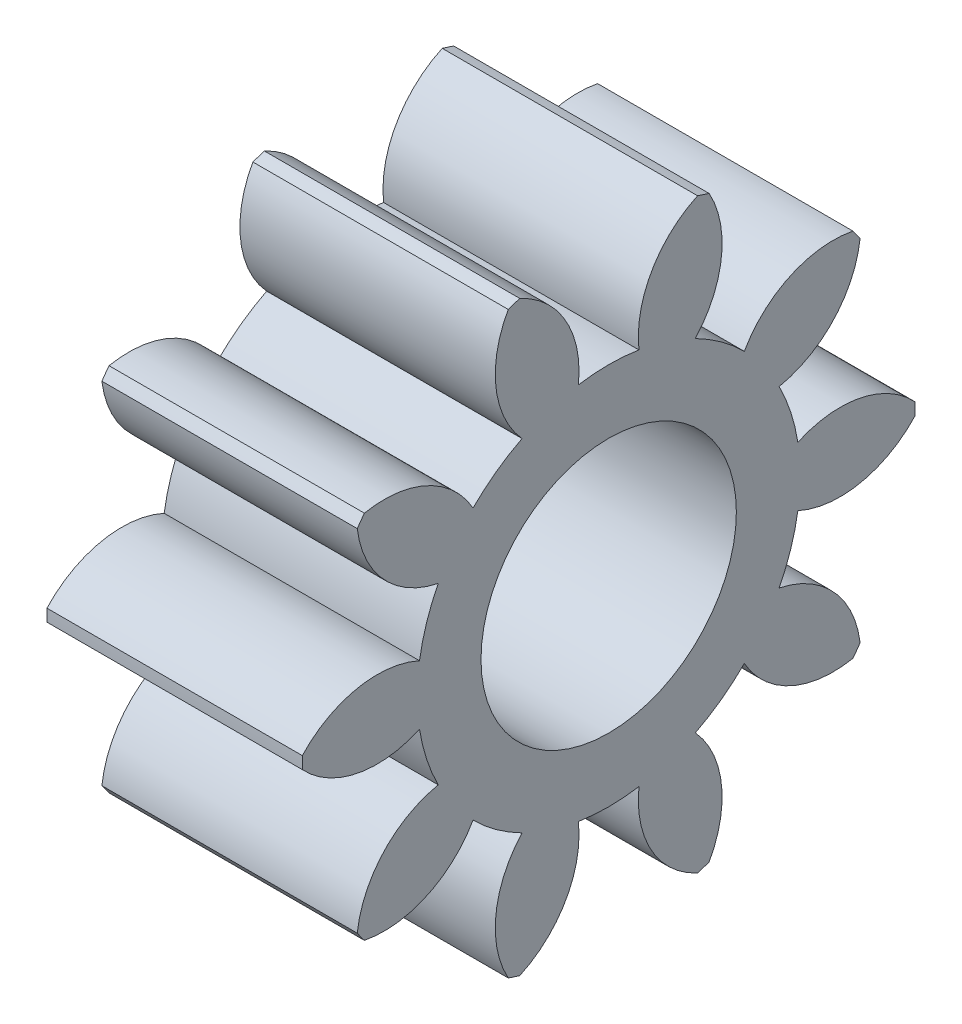
from build123d import *

# Parameters (mm, degrees)
BASPROSKE_W     = 5
BASPROSKE_H     = 6
TOOTHCUT_DEPTH  = 10.848857802
TEETHCUTS_COUNT = 10
TEETHCUTS_ANGLE = 324
BORSKE_R        = 2.5
BORE_DEPTH      = 50.0000508


with BuildPart() as part:
    # BasProSke → Base-Revolve (revolve)
    with BuildSketch(Plane(origin=(0, 0, 0), x_dir=(1, 0, 0), z_dir=(0, 1, 0)), mode=Mode.PRIVATE) as base_revolve_sk:
        with Locations((2.5, 3)):
            Rectangle(BASPROSKE_W, BASPROSKE_H)
    revolve(base_revolve_sk.sketch.rotate(Axis((-10, 0, 0), (1, 0, 0)), 180), axis=Axis((-10, 0, 0), (1, 0, 0)))

    # TooCutSke → ToothCut (cut, through all)
    with BuildSketch(Plane(origin=(0, 0, 0), x_dir=(0, 0, -1), z_dir=(1, 0, 0))):
        with BuildLine():
            ThreePointArc((0.59278292, 3.701838653), (0, 3.749), (-0.59278292, 3.701838653))
            ThreePointArc((-0.59278292, 3.701838653), (-0.846593509, 4.924114224), (-1.775771316, 5.757784417))
            ThreePointArc((-1.775771316, 5.757784417), (0, 6.0254), (1.775771316, 5.757784417))
            ThreePointArc((1.775771316, 5.757784417), (0.846593509, 4.924114224), (0.59278292, 3.701838653))
        make_face()
    toothcut = extrude(amount=TOOTHCUT_DEPTH, mode=Mode.SUBTRACT)

    # TeethCuts: ToothCut ×10 about axis
    teethcuts_axis = Axis((-10, 0, 0), (1, 0, 0))
    for i in range(1, TEETHCUTS_COUNT):
        add(toothcut.rotate(teethcuts_axis, i * TEETHCUTS_ANGLE / (TEETHCUTS_COUNT - 1)), mode=Mode.SUBTRACT)

    # BorSke → Bore (cut, symmetric)
    with BuildSketch(Plane(origin=(0, 0, 0), x_dir=(0, 0, -1), z_dir=(1, 0, 0))):
        with Locations(Location((0, 0, 0), (0, 0, 180))):
            Circle(BORSKE_R)
    extrude(amount=BORE_DEPTH, both=True, mode=Mode.SUBTRACT)


solid = part.part
